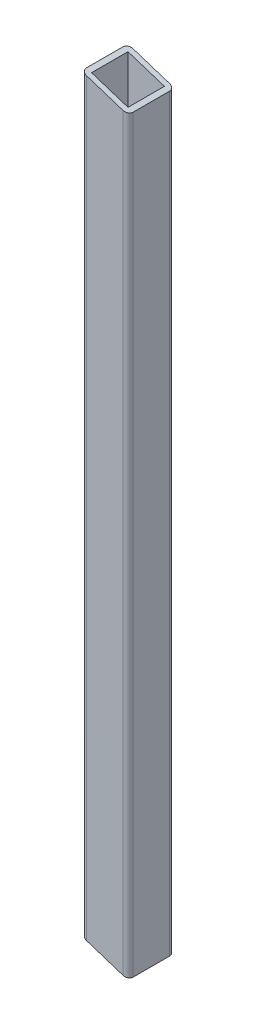
from build123d import *

# Parameters (mm, degrees)
BOSS_EXTRUDE1_DEPTH     = 420
SKETCH3_W               = 20
SKETCH3_H               = 20
CUT_EXTRUDE1_DEPTH      = 1040.5
CUT_EXTRUDE3_DEPTH      = 422.396725189
CUT_EXTRUDE3_DEPTH_BACK = 422.396725189
CUT_EXTRUDE4_DEPTH      = 422.396725189
CUT_EXTRUDE4_DEPTH_BACK = 422.396725189


with BuildPart() as part:
    # Sketch1 → Boss-Extrude1 (new body)
    with BuildSketch(Plane(origin=(0, 0, 0), x_dir=(1, 0, 0), z_dir=(0, 1, 0))):
        with BuildLine():
            Line((2.8, 0), (22.8, 0))
            ThreePointArc((22.8, 0), (24.779898987, -0.820101013), (25.6, -2.8))
            Line((25.6, -2.8), (25.6, -22.8))
            ThreePointArc((25.6, -22.8), (24.779898987, -24.779898987), (22.8, -25.6))
            Line((22.8, -25.6), (2.8, -25.6))
            ThreePointArc((2.8, -25.6), (0.820101013, -24.779898987), (0, -22.8))
            Line((0, -22.8), (0, -2.8))
            ThreePointArc((0, -2.8), (0.820101013, -0.820101013), (2.8, 0))
        make_face()
    extrude(amount=BOSS_EXTRUDE1_DEPTH)

    # Sketch3 → Cut-Extrude1 (cut)
    with BuildSketch(Plane(origin=(0, 0, 0), x_dir=(-1, 0, 0), z_dir=(0, -1, 0))):
        with Locations((-12.8, -12.8)):
            Rectangle(SKETCH3_W, SKETCH3_H)
    extrude(amount=-CUT_EXTRUDE1_DEPTH, mode=Mode.SUBTRACT)

    # Sketch5 → Cut-Extrude3 (cut, two sides: drawn at the far end of the back side and taken through both)
    with BuildSketch(Plane.XY.offset(22.8).offset(-CUT_EXTRUDE3_DEPTH_BACK)):
        Polygon((835.480673532, -263.146182429), (25.6, 0), (0, 8.317944224), (-809.880673532, 271.464126652), (-1336.173038389, -1348.297220411), (309.188308674, -1882.907529492), align=None)
    extrude(amount=CUT_EXTRUDE3_DEPTH + CUT_EXTRUDE3_DEPTH_BACK, mode=Mode.SUBTRACT)

    # Sketch4 → Cut-Extrude4 (cut, two sides: drawn at the far end of the back side and taken through both)
    with BuildSketch(Plane.XY.offset(22.8).offset(-CUT_EXTRUDE4_DEPTH_BACK)):
        Polygon((-809.880673532, 683.146182429), (0, 420), (25.6, 411.682055776), (835.480673532, 148.535873348), (1361.773038389, 1768.297220411), (-283.588308674, 2302.907529492), align=None)
    extrude(amount=CUT_EXTRUDE4_DEPTH + CUT_EXTRUDE4_DEPTH_BACK, mode=Mode.SUBTRACT)


solid = part.part
